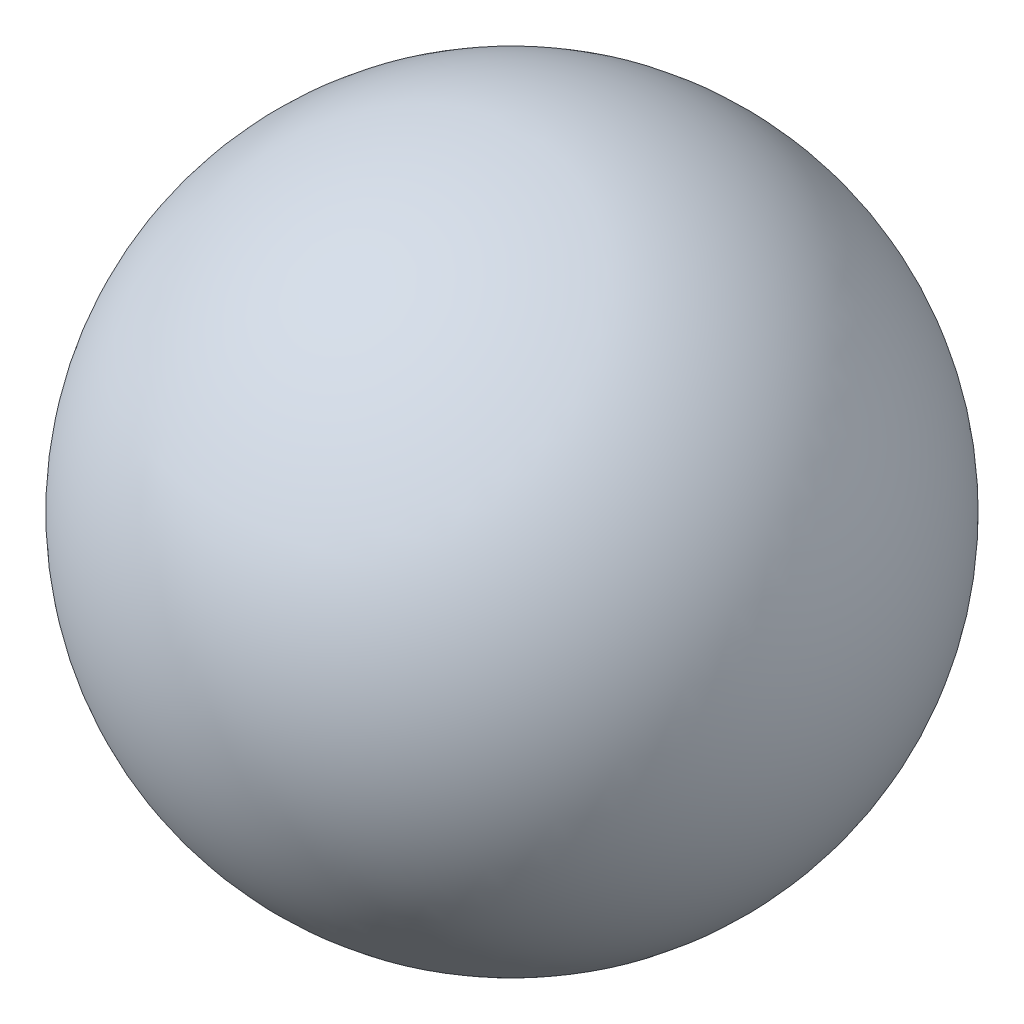
from build123d import *


with BuildPart() as part:
    # Sketch2 → Revolve1 (revolve)
    with BuildSketch(Plane.ZY.offset(-26.5)):
        with BuildLine():
            Line((-50, 66.627272727), (-50, -103.372727273))
            ThreePointArc((-50, -103.372727273), (35, -18.372727273), (-50, 66.627272727))
        make_face()
    revolve(axis=Axis((26.5, 66.627272727, -50), (0, -1, 0)))


solid = part.part
